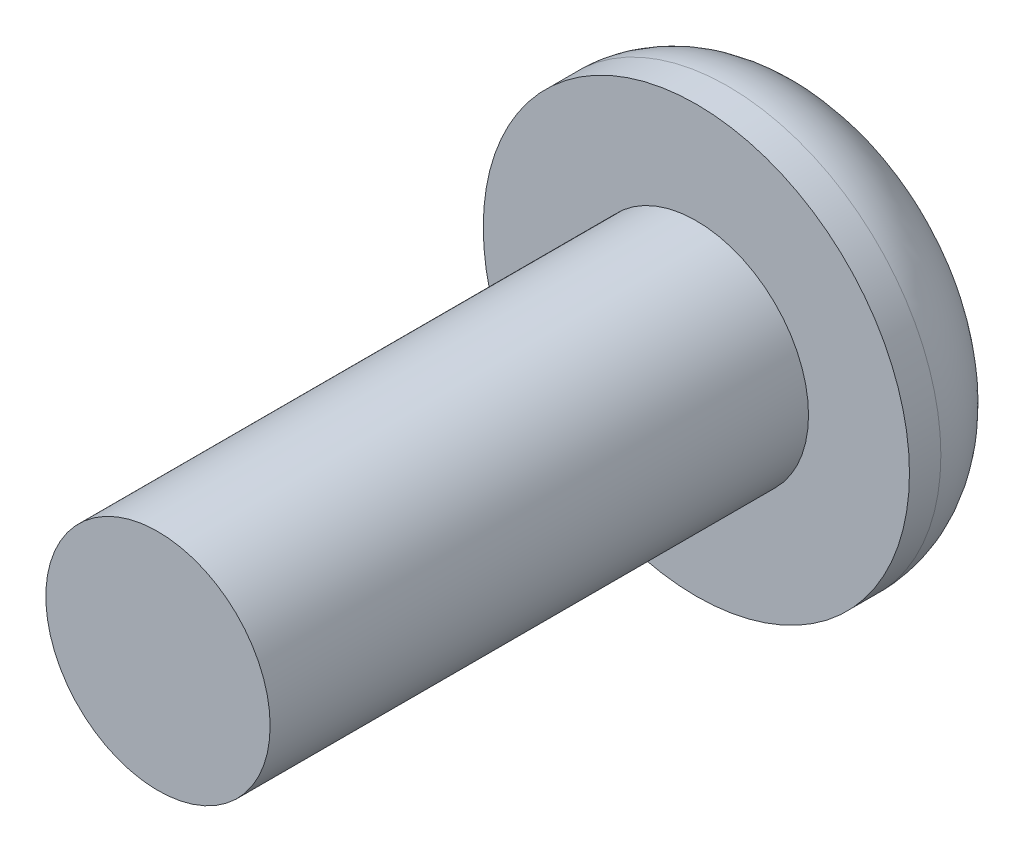
from build123d import *

# Parameters (mm, degrees)
SKETCH_1_R          = 2.5
EXTRUDE_1_DEPTH     = 12
SKETCH_2_R          = 4.75
EXTRUDE_2_DEPTH     = 2.7
FILLET_1_R          = 2
CUT_EXTRUDE_1_DEPTH = 1.56


with BuildPart() as part:
    # 草图1 → 凸台-拉伸1 (new body)
    with BuildSketch(Plane.XY):
        Circle(SKETCH_1_R)
    extrude(amount=EXTRUDE_1_DEPTH)

    # 草图2 → 凸台-拉伸2 (add)
    with BuildSketch(Plane(origin=(0, 0, 0), x_dir=(-1, 0, 0), z_dir=(0, 0, -1))):
        with Locations(Location((0, 0, 0), (0, 0, 180))):
            Circle(SKETCH_2_R)
    extrude(amount=EXTRUDE_2_DEPTH)

    # 圆角1
    fillet_1_edges = [part.edges().sort_by_distance(p)[0] for p in [
        (-4.75, 0, -2.7),
    ]]
    fillet(fillet_1_edges, radius=FILLET_1_R)

    # 草图3 → 切除-拉伸1 (cut)
    with BuildSketch(Plane(origin=(0, 0, -2.7), x_dir=(-1, 0, 0), z_dir=(0, 0, -1))):
        Polygon((1.468584034, 0.918292401), (-0.06097253, 1.730977282), (-1.529556565, 0.812684881), (-1.468584034, -0.918292401), (0.06097253, -1.730977282), (1.529556565, -0.812684881), align=None)
    extrude(amount=-CUT_EXTRUDE_1_DEPTH, mode=Mode.SUBTRACT)


solid = part.part
